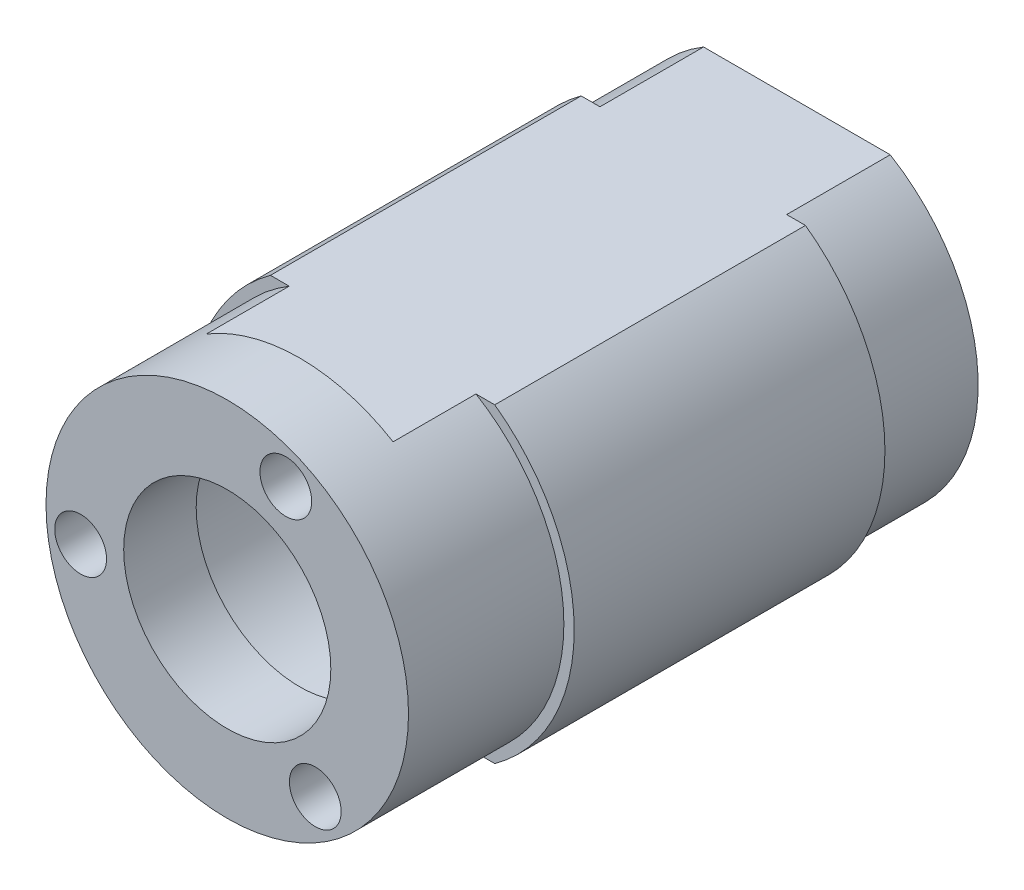
from build123d import *

# Parameters (mm, degrees)
BOSS_EXTRUDE1_DEPTH         = 30
BOSS_EXTRUDE1_DEPTH_BACK    = 25
SKETCH1_R                   = 11.5
BOSS_EXTRUDE2_DEPTH         = 15
BOSS_EXTRUDE2_DEPTH_BACK    = 15
BOSS_EXTRUDE3_START         = -7
SKETCH5_R                   = 17.5
SKETCH5_R_2                 = 10
BOSS_EXTRUDE3_DEPTH         = 7
SKETCH6_R                   = 2.5
CUT_EXTRUDE1_DEPTH          = 5
M3_TAPPED_HOLE1_D           = 2.5
M3_TAPPED_HOLE1_DEPTH       = 7.5
M3_TAPPED_HOLE1_CSINK_D     = 3.05
M3_TAPPED_HOLE1_CSINK_ANGLE = 90
M3_TAPPED_HOLE1_TIP         = 0.751075774


with BuildPart() as part:
    # Sketch1 → Boss-Extrude1 (new, two sides: drawn at the far end of the back side and taken through both)
    with BuildSketch(Plane.XY.offset(-BOSS_EXTRUDE1_DEPTH_BACK)):
        with BuildLine():
            Line((9.013878189, 15), (-9.013878189, 15))
            ThreePointArc((-9.013878189, 15), (-17.5, 0), (-9.013878189, -15))
            Line((-9.013878189, -15), (9.013878189, -15))
            ThreePointArc((9.013878189, -15), (17.5, 0), (9.013878189, 15))
        make_face()
        Circle(SKETCH1_R, mode=Mode.SUBTRACT)
    extrude(amount=BOSS_EXTRUDE1_DEPTH + BOSS_EXTRUDE1_DEPTH_BACK)

    # Sketch1<23> → Boss-Extrude2 (add, two sides: drawn at the far end of the back side and taken through both)
    with BuildSketch(Plane.XY.offset(-BOSS_EXTRUDE2_DEPTH_BACK)):
        with BuildLine():
            Line((-9.013878189, 15), (-10.828203914, 15))
            ThreePointArc((-10.828203914, 15), (-18.5, 0), (-10.828203914, -15))
            Line((-10.828203914, -15), (-9.013878189, -15))
            ThreePointArc((-9.013878189, -15), (-17.5, 0), (-9.013878189, 15))
        make_face()
        with BuildLine():
            ThreePointArc((10.828203914, -15), (18.5, 0), (10.828203914, 15))
            Line((10.828203914, 15), (9.013878189, 15))
            ThreePointArc((9.013878189, 15), (17.5, 0), (9.013878189, -15))
            Line((9.013878189, -15), (10.828203914, -15))
        make_face()
    extrude(amount=BOSS_EXTRUDE2_DEPTH + BOSS_EXTRUDE2_DEPTH_BACK)

    # Sketch5 → Boss-Extrude3 (add)
    with BuildSketch(Plane.XY.offset(30).offset(BOSS_EXTRUDE3_START)):
        Circle(SKETCH5_R)
        Circle(SKETCH5_R_2, mode=Mode.SUBTRACT)
    extrude(amount=BOSS_EXTRUDE3_DEPTH)

    # Sketch6 → Cut-Extrude1 (cut)
    with BuildSketch(Plane.XY.offset(30)):
        with Locations((5.654398175, 13.080148366)):
            Circle(SKETCH6_R)
        with Locations((8.500541683, -11.436926646)):
            Circle(SKETCH6_R)
        with Locations((-14.154939858, -1.643221721)):
            Circle(SKETCH6_R)
    extrude(amount=-CUT_EXTRUDE1_DEPTH, mode=Mode.SUBTRACT)

    # M3 Tapped Hole1
    with Locations(Plane(origin=(0, -15, 0), x_dir=(-1, 0, 0), z_dir=(0, -1, 0))):
        with Locations((0, 0)):
            CounterSinkHole(M3_TAPPED_HOLE1_D / 2, M3_TAPPED_HOLE1_CSINK_D / 2, depth=M3_TAPPED_HOLE1_DEPTH, counter_sink_angle=M3_TAPPED_HOLE1_CSINK_ANGLE)
            with Locations((0, 0, -(M3_TAPPED_HOLE1_DEPTH + M3_TAPPED_HOLE1_TIP / 2))):  # 118° drill point
                Cone(0, M3_TAPPED_HOLE1_D / 2, M3_TAPPED_HOLE1_TIP, mode=Mode.SUBTRACT)


solid = part.part
